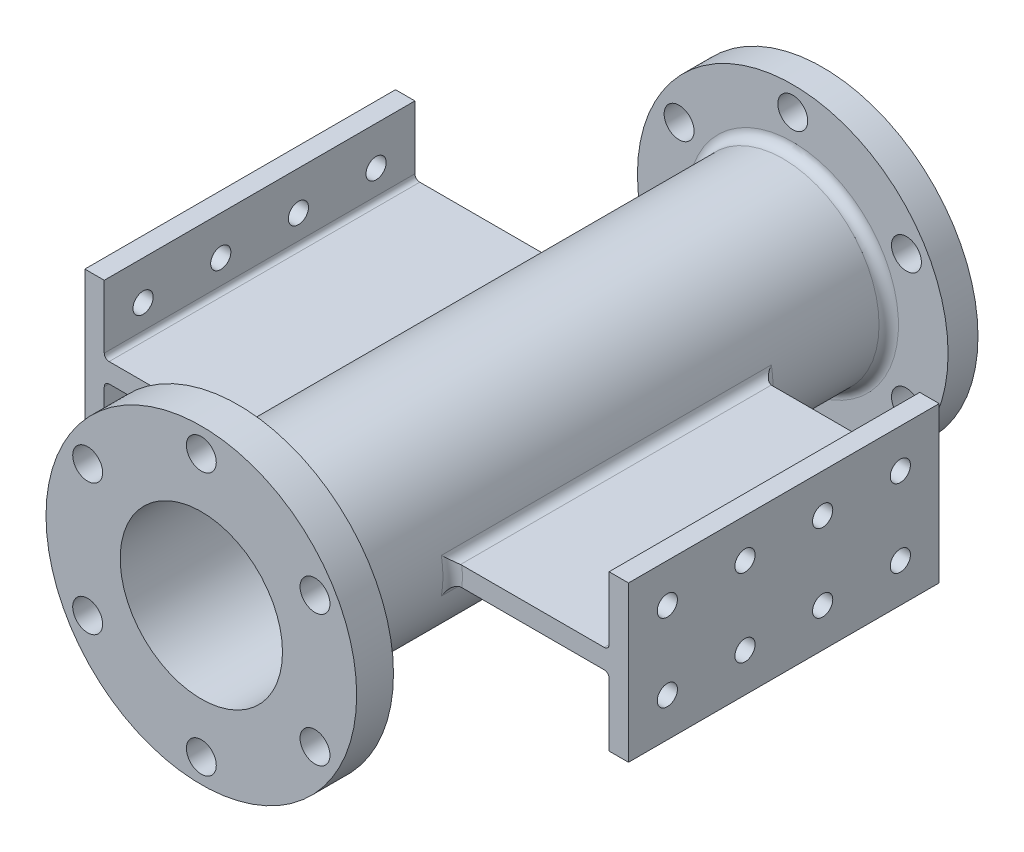
from build123d import *

# Parameters (mm, degrees)
SKETCH1_R            = 50.8
BOSS_EXTRUDE1_DEPTH  = 101.6
SKETCH2_W            = 181.3814
SKETCH2_H            = 19.4056
SKETCH3_R            = 26.543
CUT_EXTRUDE1_DEPTH   = 216.526146906
SKETCH4_R            = 4.8895
CUT_EXTRUDE2_DEPTH   = 216.526146906
CIRPATTERN1_COUNT    = 6
FILLET1_R            = 3.175
BOSS_EXTRUDE2_DEPTH  = 50.8
CUT_EXTRUDE3_REACH   = 212.988
SKETCH6_R            = 3.302
LPATTERN1_COUNT      = 4
LPATTERN1_PITCH      = 25.4
LPATTERN1_COUNT_DIR2 = 2
LPATTERN1_PITCH_DIR2 = 25.4
CUT_EXTRUDE4_REACH   = 212.988
SKETCH7_R            = 3.302
LPATTERN2_COUNT      = 4
LPATTERN2_PITCH      = 25.4
LPATTERN2_COUNT_DIR2 = 2
LPATTERN2_PITCH_DIR2 = 25.4
FILLET2_R            = 1.5875
FILLET3_R            = 3.175


with BuildPart() as part:
    # Sketch1 → Boss-Extrude1 (new, symmetric)
    with BuildSketch(Plane.XY):
        Circle(SKETCH1_R)
    extrude(amount=BOSS_EXTRUDE1_DEPTH, both=True)

    # Sketch2 → Cut-Revolve1 (revolve, cut)
    with BuildSketch(Plane(origin=(0, 0, 0), x_dir=(0, 0, -1), z_dir=(1, 0, 0)), mode=Mode.PRIVATE) as cut_revolve1_sk:
        with Locations((1.1303, 41.0972)):
            Rectangle(SKETCH2_W, SKETCH2_H)
    revolve(cut_revolve1_sk.sketch.rotate(Axis((0, 0, -88.99), (0, 0, 1)), 90), axis=Axis((0, 0, -88.99), (0, 0, 1)), mode=Mode.SUBTRACT)

    # Sketch3 → Cut-Extrude1 (cut, through all)
    with BuildSketch(Plane.XY.offset(101.6)):
        Circle(SKETCH3_R)
    extrude(amount=-CUT_EXTRUDE1_DEPTH, mode=Mode.SUBTRACT)

    # Sketch4 → Cut-Extrude2 (cut, through all)
    with BuildSketch(Plane.XY.offset(101.6)):
        with Locations((0, 42.926)):
            Circle(SKETCH4_R)
    cut_extrude2 = extrude(amount=-CUT_EXTRUDE2_DEPTH, mode=Mode.SUBTRACT)

    # CirPattern1: Cut-Extrude2 ×6 about axis
    cirpattern1_axis = Axis((0, 0, 0), (0, 0, 1))
    for i in range(1, CIRPATTERN1_COUNT):
        add(cut_extrude2.rotate(cirpattern1_axis, i * 360 / CIRPATTERN1_COUNT), mode=Mode.SUBTRACT)

    # Fillet1
    fillet1_edges = [part.edges().sort_by_distance(p)[0] for p in [
        (31.3944, 0, 89.5604),
        (31.3944, 0, -91.821),
    ]]
    fillet(fillet1_edges, radius=FILLET1_R)

    # Sketch5 → Boss-Extrude2 (add, symmetric)
    with BuildSketch(Plane.XY):
        Polygon((28.9814, 3.175), (82.55, 3.175), (82.55, 25.4), (88.9, 25.4), (88.9, -25.4), (82.55, -25.4), (82.55, -3.175), (28.9814, -3.175), align=None)
        Polygon((-28.9814, -3.175), (-28.9814, 3.175), (-82.55, 3.175), (-82.55, 25.4), (-88.9, 25.4), (-88.9, -25.4), (-82.55, -25.4), (-82.55, -3.175), align=None)
    extrude(amount=BOSS_EXTRUDE2_DEPTH, both=True)

    # Sketch6 → Cut-Extrude3 (cut, up to next)
    with BuildSketch(Plane(origin=(88.9, 0, 0), x_dir=(0, 0, -1), z_dir=(1, 0, 0)), mode=Mode.PRIVATE) as cut_extrude3_sk1:
        with Locations((-38.1, -12.7)):
            Circle(SKETCH6_R)
    cut_extrude3_tool1 = extrude(cut_extrude3_sk1.sketch, amount=-CUT_EXTRUDE3_REACH, mode=Mode.PRIVATE) & part.part
    cut_extrude3 = cut_extrude3_tool1.solids().sort_by_distance((88.9, -12.7, 38.1))[0]
    add(cut_extrude3, mode=Mode.SUBTRACT)

    # LPattern1: Cut-Extrude3 4 × 2
    with Locations(*[(0, j * LPATTERN1_PITCH_DIR2, -i * LPATTERN1_PITCH) for i in range(LPATTERN1_COUNT) for j in range(LPATTERN1_COUNT_DIR2) if (i, j) != (0, 0)]):
        add(cut_extrude3, mode=Mode.SUBTRACT)

    # Sketch7 → Cut-Extrude4 (cut, up to next)
    with BuildSketch(Plane.ZY.offset(88.9), mode=Mode.PRIVATE) as cut_extrude4_sk1:
        with Locations(Location((38.1, -12.7, 0), (0, 0, 180))):
            Circle(SKETCH7_R)
    cut_extrude4_tool1 = extrude(cut_extrude4_sk1.sketch, amount=-CUT_EXTRUDE4_REACH, mode=Mode.PRIVATE) & part.part
    cut_extrude4 = cut_extrude4_tool1.solids().sort_by_distance((-88.9, -12.7, 38.1))[0]
    add(cut_extrude4, mode=Mode.SUBTRACT)

    # LPattern2: Cut-Extrude4 4 × 2
    with Locations(*[(0, j * LPATTERN2_PITCH_DIR2, -i * LPATTERN2_PITCH) for i in range(LPATTERN2_COUNT) for j in range(LPATTERN2_COUNT_DIR2) if (i, j) != (0, 0)]):
        add(cut_extrude4, mode=Mode.SUBTRACT)

    # Fillet2
    fillet2_edges = [part.edges().sort_by_distance(p)[0] for p in [
        (82.55, 3.175, 0),
        (82.55, -3.175, 0),
        (-82.55, -3.175, 0),
        (-82.55, 3.175, 0),
    ]]
    fillet(fillet2_edges, radius=FILLET2_R)

    # Fillet3
    fillet3_edges = [part.edges().sort_by_distance(p)[0] for p in [
        (31.3944, 0, -50.8),
        (31.233439234, 3.175, 0),
        (31.233439234, -3.175, 0),
        (31.3944, 0, 50.8),
        (-31.354133986, -1.58953872, -50.8),
        (-31.233439234, 3.175, 0),
        (-31.233439234, -3.175, 0),
        (-31.354133986, -1.58953872, 50.8),
    ]]
    fillet(fillet3_edges, radius=FILLET3_R)


solid = part.part
